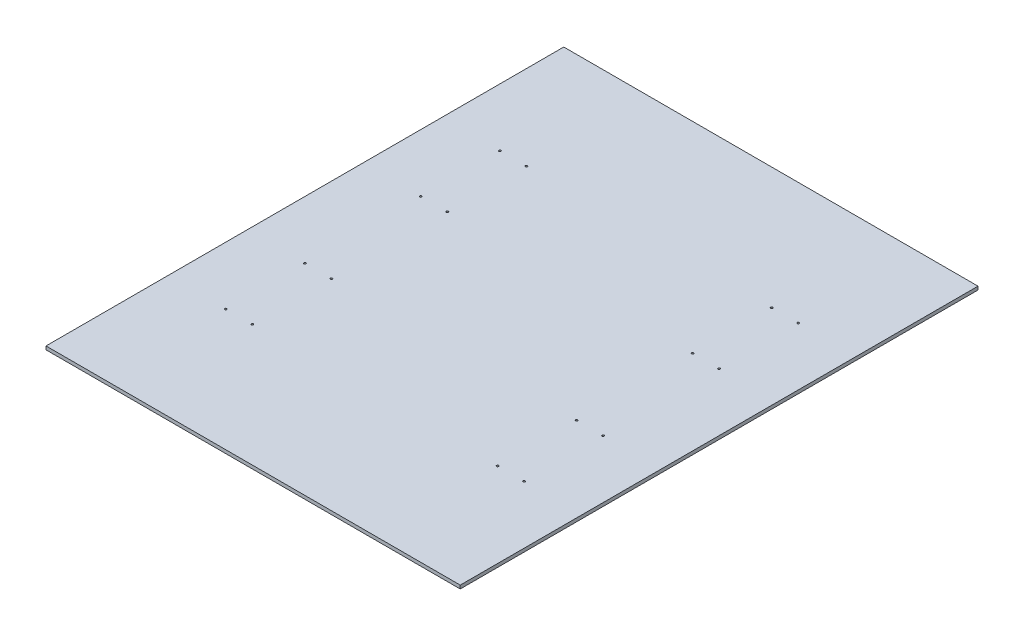
from build123d import *

# Parameters (mm, degrees)
SKETCH1_W                                  = 1219.2
SKETCH1_H                                  = 1524
BOSS_EXTRUDE1_DEPTH                        = 10
SKETCH2_R                                  = 3
CUT_EXTRUDE1_DEPTH                         = 976.887370551
MIRROR1_AT_THE_SECOND_PLANE_COPY_1_SKETC_R = 3
MIRROR1_AT_THE_SECOND_PLANE_COPY_1_DEPTH   = 976.887370551


with BuildPart() as part:
    # Sketch1 → Boss-Extrude1 (new body)
    with BuildSketch(Plane(origin=(0, 0, 0), x_dir=(1, 0, 0), z_dir=(0, 1, 0))):
        Rectangle(SKETCH1_W, SKETCH1_H)
    extrude(amount=BOSS_EXTRUDE1_DEPTH)

    # Sketch2 → Cut-Extrude1 (cut, through all)
    with BuildSketch(Plane(origin=(0, 10, 0), x_dir=(1, 0, 0), z_dir=(0, 1, 0))):
        with Locations(Location((-439, 403.35, 0), (0, 0, 270))):
            Circle(SKETCH2_R)
        with Locations(Location((-361, 403.35, 0), (0, 0, 270))):
            Circle(SKETCH2_R)
        with Locations(Location((-361, 170.65, 0), (0, 0, 270))):
            Circle(SKETCH2_R)
        with Locations(Location((-439, 170.65, 0), (0, 0, 270))):
            Circle(SKETCH2_R)
    cut_extrude1 = extrude(amount=-CUT_EXTRUDE1_DEPTH, mode=Mode.SUBTRACT)

    # Mirror1: Cut-Extrude1 across plane
    add(cut_extrude1.mirror(Plane(origin=(0, 0, 0), x_dir=(0, 0, 1), z_dir=(1, 0, 0))), mode=Mode.SUBTRACT)

    # Mirror1 at the second plane: Cut-Extrude1 across plane
    add(cut_extrude1.mirror(Plane.XY), mode=Mode.SUBTRACT)

    # Mirror1 at the second plane copy 1 sketc → Mirror1 at the second plane copy 1 (cut, through all)
    with BuildSketch(Plane(origin=(0, 10, 0), x_dir=(-1, 0, 0), z_dir=(0, 1, 0))):
        with Locations(Location((-439, 403.35, 0), (0, 0, 270))):
            Circle(MIRROR1_AT_THE_SECOND_PLANE_COPY_1_SKETC_R)
        with Locations(Location((-361, 403.35, 0), (0, 0, 270))):
            Circle(MIRROR1_AT_THE_SECOND_PLANE_COPY_1_SKETC_R)
        with Locations(Location((-361, 170.65, 0), (0, 0, 270))):
            Circle(MIRROR1_AT_THE_SECOND_PLANE_COPY_1_SKETC_R)
        with Locations(Location((-439, 170.65, 0), (0, 0, 270))):
            Circle(MIRROR1_AT_THE_SECOND_PLANE_COPY_1_SKETC_R)
    extrude(amount=-MIRROR1_AT_THE_SECOND_PLANE_COPY_1_DEPTH, mode=Mode.SUBTRACT)


solid = part.part
